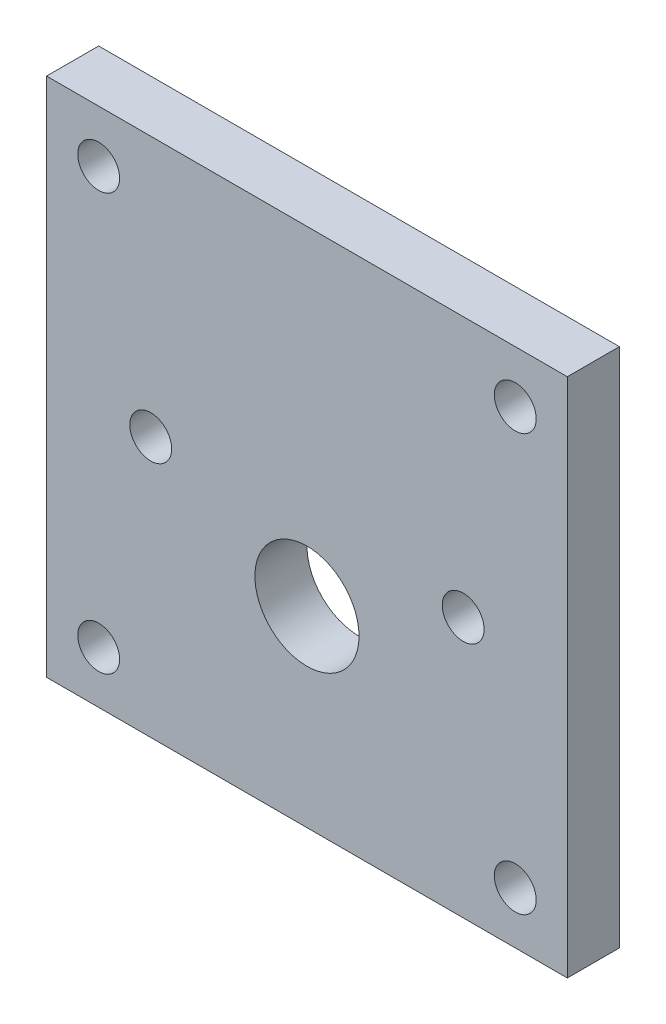
from build123d import *

# Parameters (mm, degrees)
SKETCH1_W              = 63.5
SKETCH1_H              = 63.5
BOSS_EXTRUDE1_DEPTH    = 6.35
F_10_CLEARANCE_HOLE3_D = 5.1054
F_10_CLEARANCE_HOLE2_D = 5.1054
HOLE1_D                = 12.7


with BuildPart() as part:
    # Sketch1 → Boss-Extrude1 (new body)
    with BuildSketch(Plane.XY):
        Rectangle(SKETCH1_W, SKETCH1_H)
    extrude(amount=BOSS_EXTRUDE1_DEPTH)

    # #10 Clearance Hole3 (through all)
    with Locations(Plane.XY.offset(6.35)):
        with Locations((-25.4, 25.4), (25.4, -25.4), (-25.4, -25.4), (25.4, 25.4)):
            Hole(F_10_CLEARANCE_HOLE3_D / 2)

    # #10 Clearance Hole2 (through all)
    with Locations(Plane.XY.offset(6.35)):
        with Locations((-19.05, 0), (19.05, 0)):
            Hole(F_10_CLEARANCE_HOLE2_D / 2)

    # Hole1 (through all)
    with Locations(Plane.XY.offset(6.35)):
        with Locations((0, -8.3566)):
            Hole(HOLE1_D / 2)


solid = part.part
